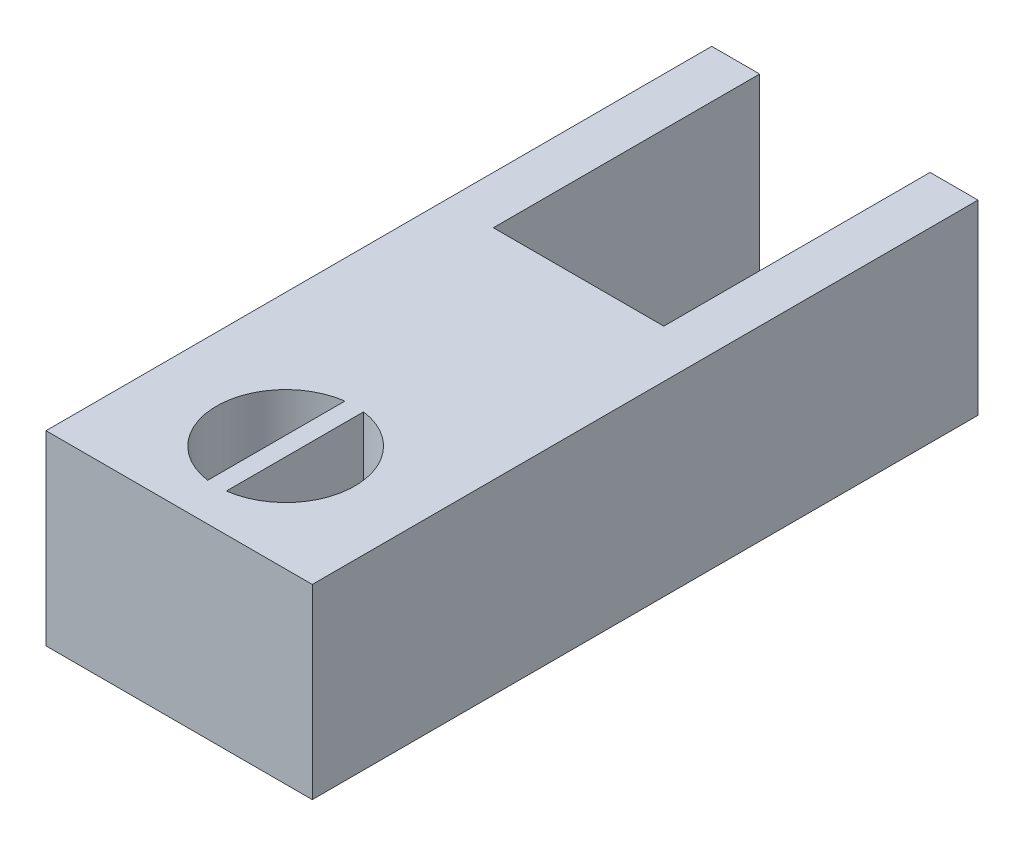
from build123d import *

# Parameters (mm, degrees)
SKETCH1_W           = 12.7
SKETCH1_H           = 31.75
BOSS_EXTRUDE1_DEPTH = 8.89
SKETCH2_W           = 8.128
SKETCH2_H           = 12.7
CUT_EXTRUDE1_DEPTH  = 8.89


with BuildPart() as part:
    # Sketch1 → Boss-Extrude1 (new body)
    with BuildSketch(Plane(origin=(0, 0, 0), x_dir=(1, 0, 0), z_dir=(0, 1, 0))):
        with Locations((6.35, 15.875)):
            Rectangle(SKETCH1_W, SKETCH1_H)
    extrude(amount=BOSS_EXTRUDE1_DEPTH)

    # Sketch2 → Cut-Extrude1 (cut)
    with BuildSketch(Plane(origin=(0, 8.89, 0), x_dir=(1, 0, 0), z_dir=(0, 1, 0))):
        with Locations((6.35, 25.4)):
            Rectangle(SKETCH2_W, SKETCH2_H)
        with BuildLine():
            ThreePointArc((9.652, 5.08), (8.837060816, 7.252034185), (6.7945, 8.351944949))
            Line((6.7945, 8.351944949), (6.7945, 1.808055051))
            ThreePointArc((6.7945, 1.808055051), (8.837060816, 2.907965815), (9.652, 5.08))
        make_face()
        with BuildLine():
            Line((5.9055, 1.808055051), (5.9055, 8.351944949))
            ThreePointArc((5.9055, 8.351944949), (3.048, 5.08), (5.9055, 1.808055051))
        make_face()
    extrude(amount=-CUT_EXTRUDE1_DEPTH, mode=Mode.SUBTRACT)


solid = part.part
